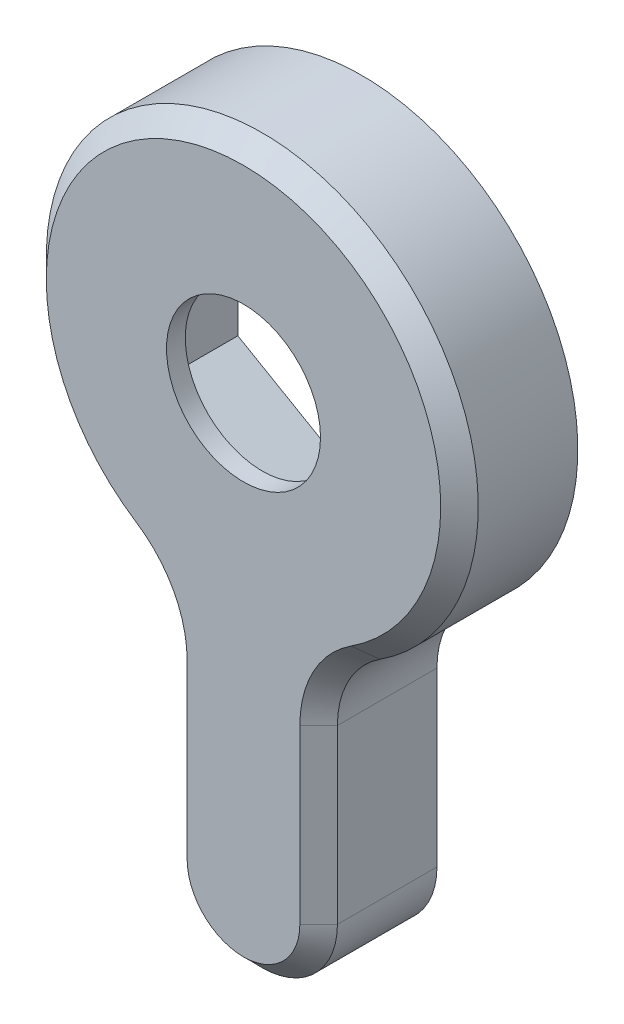
from build123d import *

# Parameters (mm, degrees)
SKETCH1_R           = 11.5
BOSS_EXTRUDE1_DEPTH = 5.3
BOSS_EXTRUDE2_START = 1
SKETCH2_R           = 11.5
BOSS_EXTRUDE2_DEPTH = 1
BOSS_EXTRUDE3_DEPTH = 6.3
FILLET1_R           = 5
CHAMFER1_SIZE       = 1
CUT_EXTRUDE1_REACH  = 32.016
SKETCH4_R           = 4.1


with BuildPart() as part:
    # Sketch1 → Boss-Extrude1 (new body)
    with BuildSketch(Plane.XY):
        Circle(SKETCH1_R)
        Polygon((0, 7.621023553), (-6.6, 3.810511777), (-6.6, -3.810511777), (0, -7.621023553), (6.6, -3.810511777), (6.6, 3.810511777), align=None, mode=Mode.SUBTRACT)
    extrude(amount=-BOSS_EXTRUDE1_DEPTH)

    # Sketch2 → Boss-Extrude2 (add)
    with BuildSketch(Plane.XY.offset(BOSS_EXTRUDE2_START)):
        Circle(SKETCH2_R)
    extrude(amount=-BOSS_EXTRUDE2_DEPTH)

    # Sketch3 → Boss-Extrude3 (add)
    with BuildSketch(Plane.XY.offset(1)):
        with BuildLine():
            Line((4, -23), (4, -10.781929326))
            ThreePointArc((4, -10.781929326), (0, -11.5), (-4, -10.781929326))
            Line((-4, -10.781929326), (-4, -23))
            ThreePointArc((-4, -23), (0, -27), (4, -23))
        make_face()
    extrude(amount=-BOSS_EXTRUDE3_DEPTH)

    # Fillet1
    fillet1_edges = [part.edges().sort_by_distance(p)[0] for p in [
        (4, -10.781929326, -2.15),
        (-4, -10.781929326, -2.15),
    ]]
    fillet(fillet1_edges, radius=FILLET1_R)

    # Chamfer1
    chamfer1_edges = [part.edges().sort_by_distance(p)[0] for p in [
        (0, -27, 1),
        (0, 11.5, 1),
        (-4, -18.414658343, 1),
        (4, -18.414658343, 1),
        (-4.604754635, -11.445660213, 1),
        (4.604754635, -11.445660213, 1),
    ]]
    chamfer(chamfer1_edges, length=CHAMFER1_SIZE)

    # Sketch4 → Cut-Extrude1 (cut, up to next)
    with BuildSketch(Plane.XY.offset(1), mode=Mode.PRIVATE) as cut_extrude1_sk1:
        Circle(SKETCH4_R)
    cut_extrude1_tool1 = extrude(cut_extrude1_sk1.sketch, amount=-CUT_EXTRUDE1_REACH, mode=Mode.PRIVATE) & part.part
    add(cut_extrude1_tool1.solids().sort_by_distance((0, 0, 1))[0], mode=Mode.SUBTRACT)


solid = part.part
